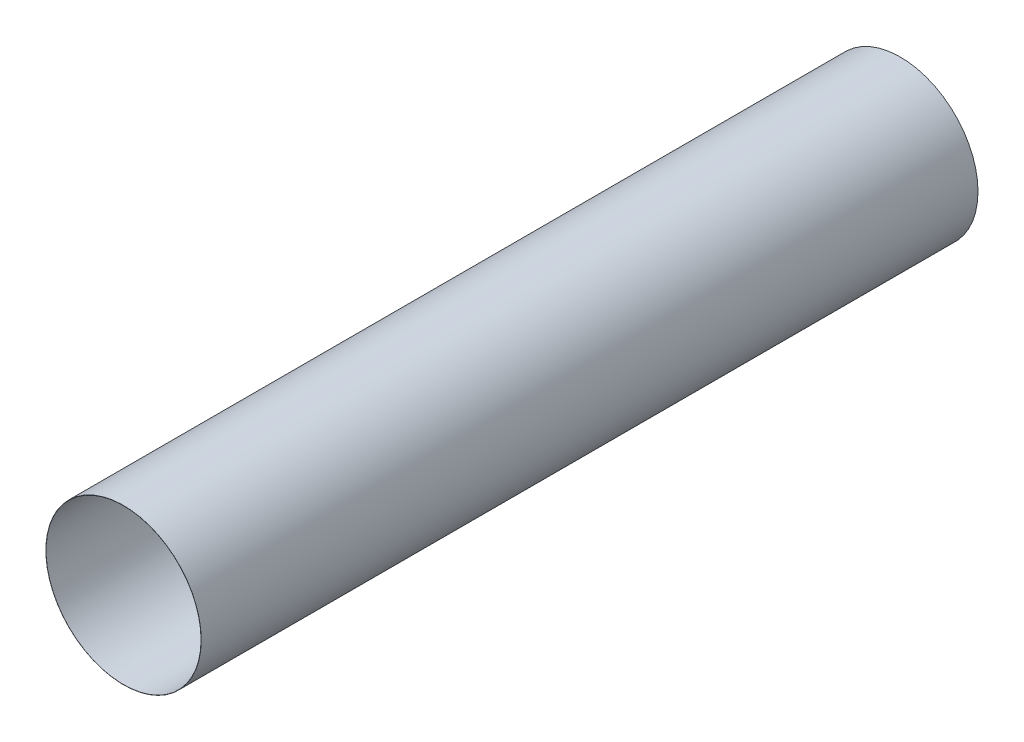
from build123d import *

# Parameters (mm, degrees)
SKETCH2_R           = 1000
SKETCH2_R_2         = 998
BOSS_EXTRUDE1_DEPTH = 10000


with BuildPart() as part:
    # Sketch2 → Boss-Extrude1 (new body)
    with BuildSketch(Plane.XY):
        Circle(SKETCH2_R)
        Circle(SKETCH2_R_2, mode=Mode.SUBTRACT)
    extrude(amount=BOSS_EXTRUDE1_DEPTH)


solid = part.part
